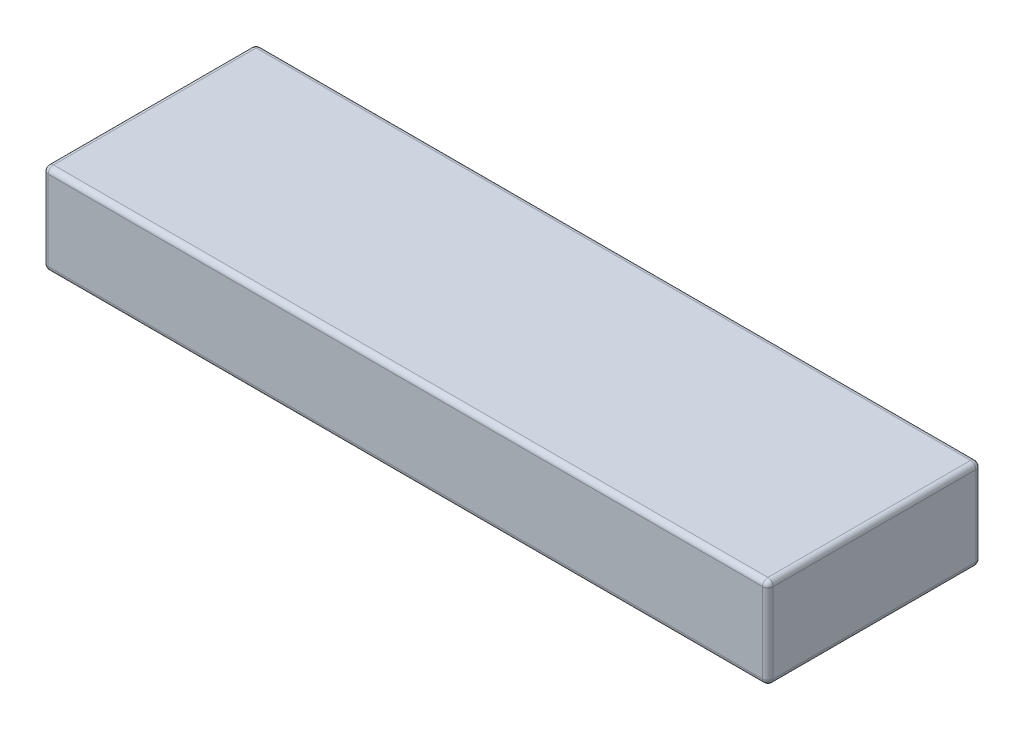
from build123d import *

# Parameters (mm, degrees)
SKETCH_1_W      = 136
SKETCH_1_H      = 40
EXTRUDE_1_DEPTH = 17
FILLET_1_R      = 1


with BuildPart() as part:
    # 草图1 → 凸台-拉伸1 (new body)
    with BuildSketch(Plane(origin=(0, 0, 0), x_dir=(1, 0, 0), z_dir=(0, 1, 0))):
        Rectangle(SKETCH_1_W, SKETCH_1_H)
    extrude(amount=EXTRUDE_1_DEPTH)

    # 圆角1
    fillet_1_edges = [part.edges().sort_by_distance(p)[0] for p in [
        (-68, 17, 0),
        (0, 17, 20),
        (68, 17, 0),
        (0, 0, 20),
        (-68, 0, 0),
        (0, 0, -20),
        (68, 0, 0),
        (68, 8.5, 20),
        (-68, 8.5, 20),
        (-68, 8.5, -20),
        (68, 8.5, -20),
        (0, 17, -20),
    ]]
    fillet(fillet_1_edges, radius=FILLET_1_R)


solid = part.part
